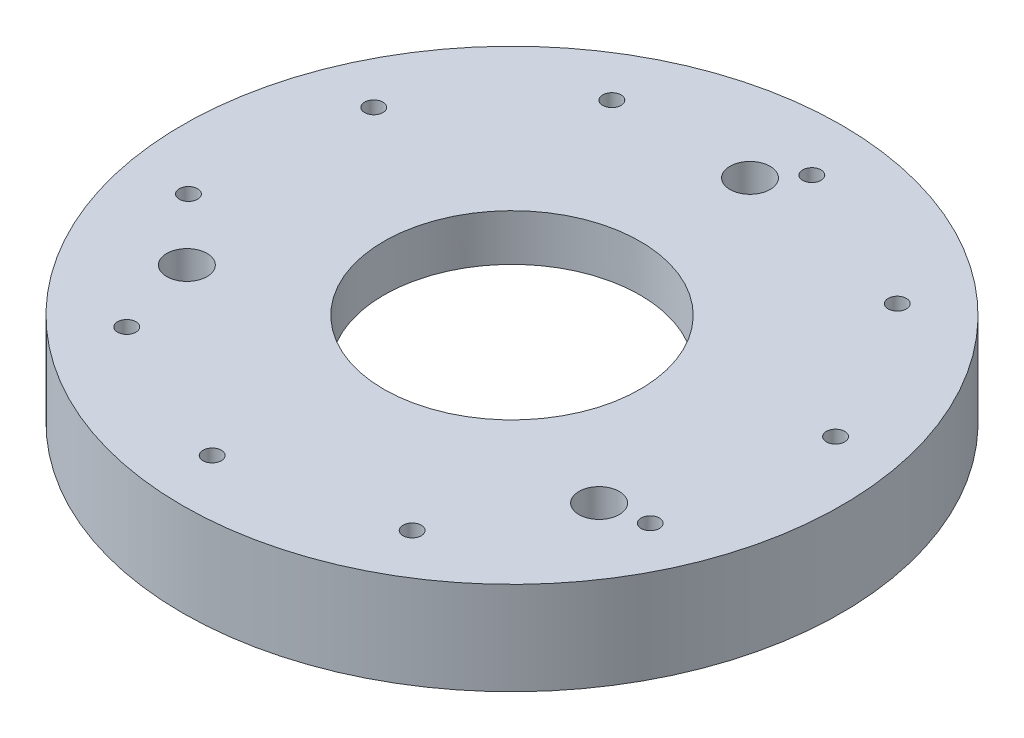
from build123d import *

# Parameters (mm, degrees)
SKETCH1_R           = 45
SKETCH1_R_2         = 2.75
SKETCH1_R_3         = 1.25
BOSS_EXTRUDE1_DEPTH = 12.7
SKETCH2_R           = 17.5
CUT_EXTRUDE1_DEPTH  = 6.35
SKETCH3_R           = 6
CUT_EXTRUDE2_DEPTH  = 64.95562915
SKETCH4_R           = 28.5
CUT_EXTRUDE3_DEPTH  = 6.35
SKETCH6_R           = 4.25
CUT_EXTRUDE4_DEPTH  = 6.35


with BuildPart() as part:
    # Sketch1 → Boss-Extrude1 (new body)
    with BuildSketch(Plane(origin=(0, 0, 0), x_dir=(1, 0, 0), z_dir=(0, 1, 0))):
        with Locations(Location((0, 0, 0), (0, 0, 270))):
            Circle(SKETCH1_R)
        with Locations(Location((0, 32.5, 0), (0, 0, 270))):
            Circle(SKETCH1_R_2, mode=Mode.SUBTRACT)
        with Locations(Location((28.145825623, -16.25, 0), (0, 0, 270))):
            Circle(SKETCH1_R_2, mode=Mode.SUBTRACT)
        with Locations(Location((-28.145825623, -16.25, 0), (0, 0, 270))):
            Circle(SKETCH1_R_2, mode=Mode.SUBTRACT)
        with Locations(Location((-36.435998127, -7.744710483, 0), (0, 0, 270))):
            Circle(SKETCH1_R_3, mode=Mode.SUBTRACT)
        with Locations(Location((-34.029568297, 15.150939955, 0), (0, 0, 270))):
            Circle(SKETCH1_R_3, mode=Mode.SUBTRACT)
        with Locations(Location((-18.625, 32.259446291, 0), (0, 0, 270))):
            Circle(SKETCH1_R_3, mode=Mode.SUBTRACT)
        with Locations(Location((3.893685257, 37.045940602, 0), (0, 0, 270))):
            Circle(SKETCH1_R_3, mode=Mode.SUBTRACT)
        with Locations(Location((24.925115087, 27.682144749, 0), (0, 0, 270))):
            Circle(SKETCH1_R_3, mode=Mode.SUBTRACT)
        with Locations(Location((36.435998127, 7.744710483, 0), (0, 0, 270))):
            Circle(SKETCH1_R_3, mode=Mode.SUBTRACT)
        with Locations(Location((34.029568297, -15.150939955, 0), (0, 0, 270))):
            Circle(SKETCH1_R_3, mode=Mode.SUBTRACT)
        with Locations(Location((18.625, -32.259446291, 0), (0, 0, 270))):
            Circle(SKETCH1_R_3, mode=Mode.SUBTRACT)
        with Locations(Location((-3.893685257, -37.045940602, 0), (0, 0, 270))):
            Circle(SKETCH1_R_3, mode=Mode.SUBTRACT)
        with Locations(Location((-24.925115087, -27.682144749, 0), (0, 0, 270))):
            Circle(SKETCH1_R_3, mode=Mode.SUBTRACT)
    extrude(amount=BOSS_EXTRUDE1_DEPTH)

    # Sketch2 → Cut-Extrude1 (cut)
    with BuildSketch(Plane(origin=(0, 12.7, 0), x_dir=(1, 0, 0), z_dir=(0, 1, 0))):
        with Locations(Location((0, 0, 0), (0, 0, 270))):
            Circle(SKETCH2_R)
    extrude(amount=-CUT_EXTRUDE1_DEPTH, mode=Mode.SUBTRACT)

    # Sketch3 → Cut-Extrude2 (cut, through all)
    with BuildSketch(Plane(origin=(0, 6.35, 0), x_dir=(1, 0, 0), z_dir=(0, 1, 0))):
        with Locations(Location((0, 0, 0), (0, 0, 270))):
            Circle(SKETCH3_R)
    extrude(amount=-CUT_EXTRUDE2_DEPTH, mode=Mode.SUBTRACT)

    # Sketch4 → Cut-Extrude3 (cut)
    with BuildSketch(Plane.XZ):
        with Locations(Location((0, 0, 0), (0, 0, 270))):
            Circle(SKETCH4_R)
    extrude(amount=-CUT_EXTRUDE3_DEPTH, mode=Mode.SUBTRACT)

    # Sketch6 → Cut-Extrude4 (cut)
    with BuildSketch(Plane.XZ):
        with Locations((28.145825623, 16.25)):
            Circle(SKETCH6_R)
        with Locations((0, -32.5)):
            Circle(SKETCH6_R)
        with Locations((-28.145825623, 16.25)):
            Circle(SKETCH6_R)
    extrude(amount=-CUT_EXTRUDE4_DEPTH, mode=Mode.SUBTRACT)


solid = part.part
